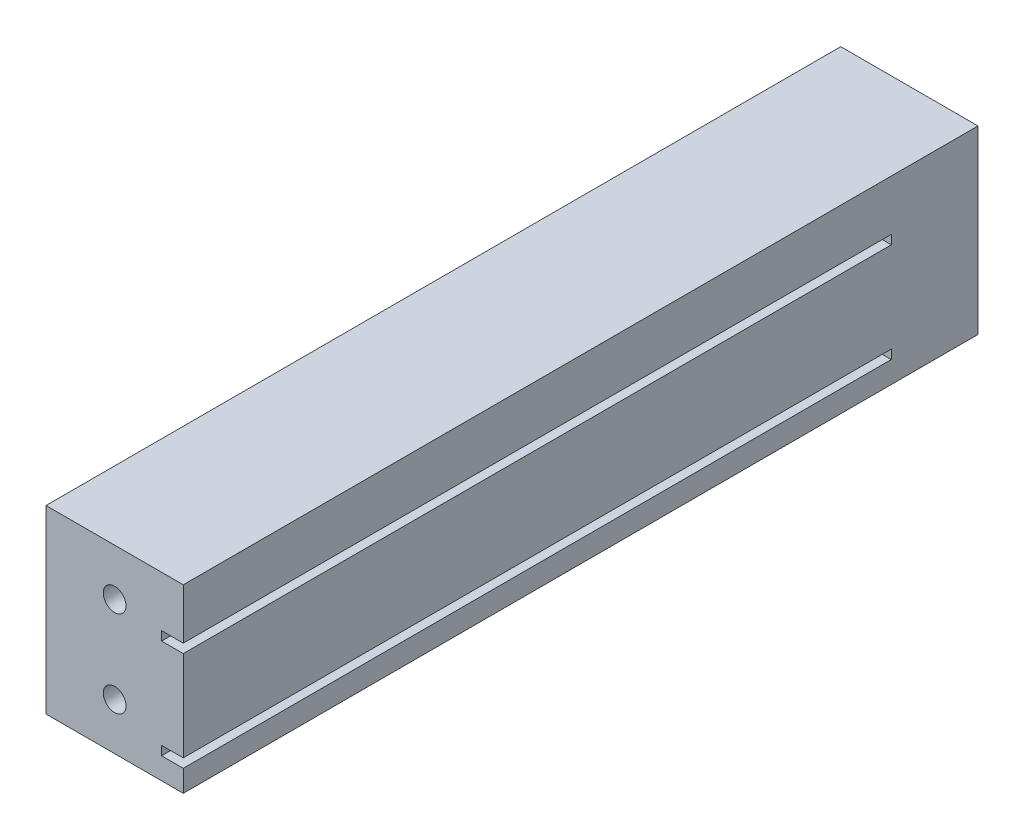
from build123d import *

# Parameters (mm, degrees)
SKETCH1_W                    = 19
SKETCH1_H                    = 110
BLOCK_DEPTH                  = 25
SKETCH2_W                    = 98
SKETCH2_H                    = 1.25
SLIDES_DEPTH                 = 3
SKETCH3_R                    = 1.5
MOUNTING_HOLES_DEPTH         = 10
SKETCH5_R                    = 1.575
CUT_EXTRUDE1_DEPTH           = 15
CUT_EXTRUDE1_DRAFT           = -1
CUT_EXTRUDE1_PROFILE_2_DEPTH = 15
CUT_EXTRUDE1_PROFILE_2_DRAFT = -1


with BuildPart() as part:
    # Sketch1 → Block (new body)
    with BuildSketch(Plane(origin=(0, 0, 0), x_dir=(1, 0, 0), z_dir=(0, 1, 0))):
        Rectangle(SKETCH1_W, SKETCH1_H)
    extrude(amount=BLOCK_DEPTH)

    # Sketch2 → Slides (cut)
    with BuildSketch(Plane(origin=(9.5, 0, 0), x_dir=(0, 0, -1), z_dir=(1, 0, 0))):
        with Locations((-6, 3.625)):
            Rectangle(SKETCH2_W, SKETCH2_H)
        with Locations((-6, 17.375)):
            Rectangle(SKETCH2_W, SKETCH2_H)
    extrude(amount=-SLIDES_DEPTH, mode=Mode.SUBTRACT)

    # Sketch3 → Mounting Holes (cut)
    with BuildSketch(Plane.ZY.offset(9.5)):
        with Locations((-50, 6)):
            Circle(SKETCH3_R)
        with Locations((51, 6)):
            Circle(SKETCH3_R)
    extrude(amount=-MOUNTING_HOLES_DEPTH, mode=Mode.SUBTRACT)


with BuildPart() as cut_extrude1_tool:
    # Sketch5 → Cut-Extrude1 (with draft: the straight prism first)
    with BuildSketch(Plane.XY.offset(55)):
        with Locations((0, 18.5)):
            Circle(SKETCH5_R)
    extrude(amount=-CUT_EXTRUDE1_DEPTH)
    # Cut-Extrude1: the draft: its side faces are tilted about the plane it starts from
    cut_extrude1_sides = [cut_extrude1_tool.faces().sort_by_distance(p)[0] for p in [
        (-1.575, 18.5, 47.5),
    ]]
    draft(cut_extrude1_sides, Plane.XY.offset(55), CUT_EXTRUDE1_DRAFT)


with BuildPart() as part_1:
    add(part.part)

    # Cut-Extrude1: cut by cut_extrude1_tool
    add(cut_extrude1_tool.part, mode=Mode.SUBTRACT)


with BuildPart() as cut_extrude1_profile_2_tool:
    # Sketch5 → Cut-Extrude1 profile 2 (with draft: the straight prism first)
    with BuildSketch(Plane.XY.offset(55)):
        with Locations((0, 6.5)):
            Circle(SKETCH5_R)
    extrude(amount=-CUT_EXTRUDE1_PROFILE_2_DEPTH)
    # Cut-Extrude1 profile 2: the draft: its side faces are tilted about the plane it starts from
    cut_extrude1_profile_2_sides = [cut_extrude1_profile_2_tool.faces().sort_by_distance(p)[0] for p in [
        (-1.575, 6.5, 47.5),
    ]]
    draft(cut_extrude1_profile_2_sides, Plane.XY.offset(55), CUT_EXTRUDE1_PROFILE_2_DRAFT)


with BuildPart() as part_2:
    add(part_1.part)

    # Cut-Extrude1 profile 2: cut by cut_extrude1_profile_2_tool
    add(cut_extrude1_profile_2_tool.part, mode=Mode.SUBTRACT)


solid = part_2.part
